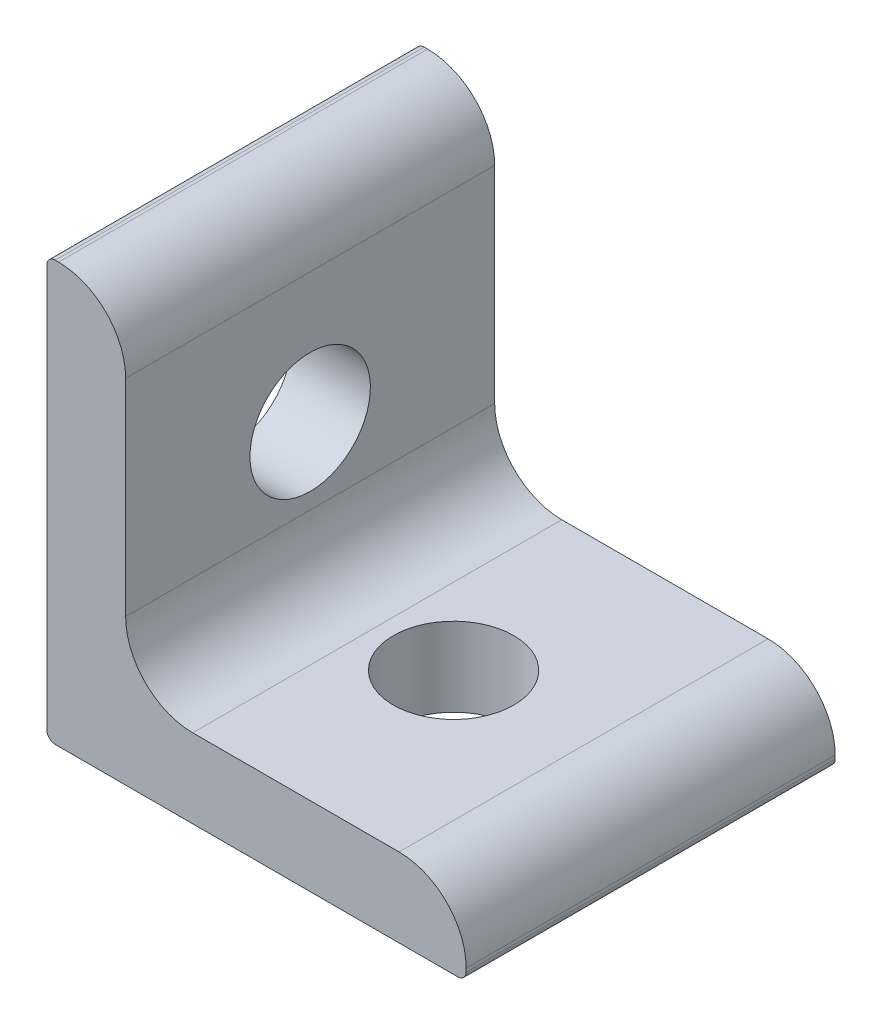
from build123d import *

# Parameters (mm, degrees)
BOSS_EXTRUDE1_DEPTH = 22
SKETCH2_R           = 3.59
CUT_EXTRUDE1_DEPTH  = 42.641325627
SKETCH3_R           = 3.59
CUT_EXTRUDE2_DEPTH  = 42.641325627
FILLET1_R           = 4
FILLET2_R           = 0.5


with BuildPart() as part:
    # Sketch1 → Boss-Extrude1 (new body)
    with BuildSketch(Plane.XY):
        Polygon((0, 0), (25, 0), (25, 4.7), (4.7, 4.7), (4.7, 25), (0, 25), align=None)
    extrude(amount=BOSS_EXTRUDE1_DEPTH)

    # Sketch2 → Cut-Extrude1 (cut, through all)
    with BuildSketch(Plane.XZ):
        with Locations(Location((13.25, 11, 0), (0, 0, 270))):
            Circle(SKETCH2_R)
    extrude(amount=-CUT_EXTRUDE1_DEPTH, mode=Mode.SUBTRACT)

    # Sketch3 → Cut-Extrude2 (cut, through all)
    with BuildSketch(Plane.ZY):
        with Locations(Location((11, 13.25, 0), (0, 0, 270))):
            Circle(SKETCH3_R)
    extrude(amount=-CUT_EXTRUDE2_DEPTH, mode=Mode.SUBTRACT)

    # Fillet1
    fillet1_edges = [part.edges().sort_by_distance(p)[0] for p in [
        (4.7, 25, 11),
        (4.7, 4.7, 11),
        (25, 4.7, 11),
    ]]
    fillet(fillet1_edges, radius=FILLET1_R)

    # Fillet2
    fillet2_edges = [part.edges().sort_by_distance(p)[0] for p in [
        (0, 25, 11),
        (25, 0, 11),
        (0, 0, 11),
    ]]
    fillet(fillet2_edges, radius=FILLET2_R)


solid = part.part
